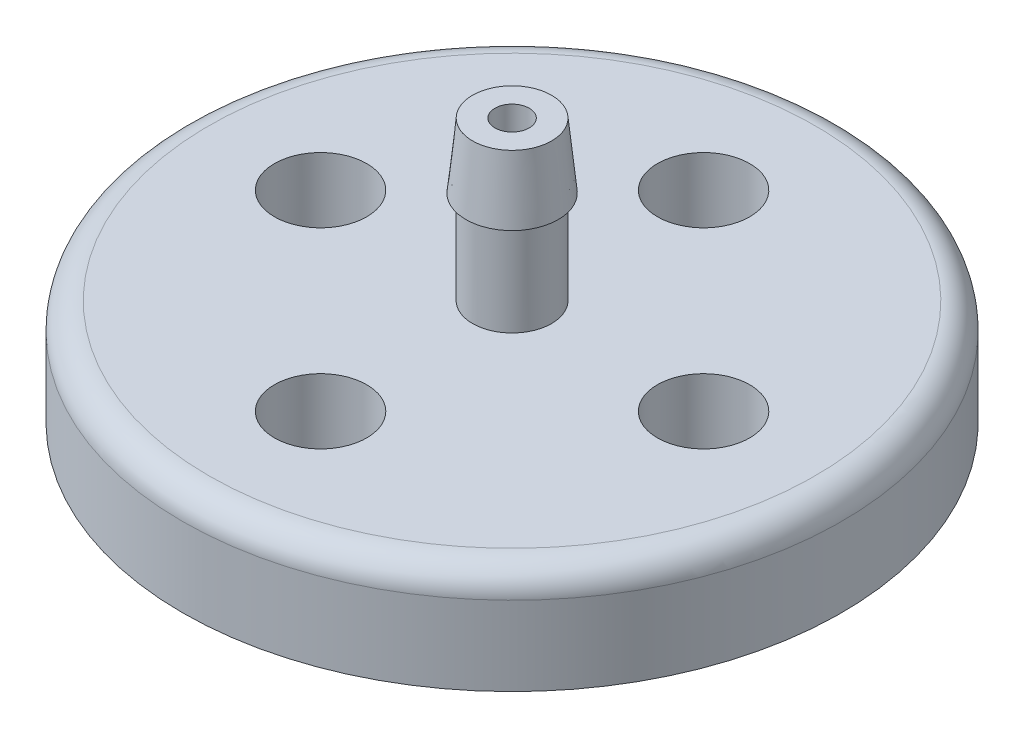
from build123d import *

# Parameters (mm, degrees)
SKETCH1_R           = 12.5
BOSS_EXTRUDE1_DEPTH = 4
SKETCH2_R           = 1.5
BOSS_EXTRUDE2_DEPTH = 6
FILLET1_R           = 1
CUT_EXTRUDE1_REACH  = 22.31
SKETCH6_R           = 0.65
CUT_EXTRUDE2_REACH  = 22.31
SKETCH7_R           = 1.75
CIRPATTERN1_COUNT   = 4


with BuildPart() as part:
    # Sketch1 → Boss-Extrude1 (new body)
    with BuildSketch(Plane(origin=(0, 0, 0), x_dir=(1, 0, 0), z_dir=(0, 1, 0))):
        with Locations(Location((0, 0, 0), (0, 0, 270))):
            Circle(SKETCH1_R)
    extrude(amount=BOSS_EXTRUDE1_DEPTH)

    # Sketch2 → Boss-Extrude2 (add)
    with BuildSketch(Plane(origin=(0, 4, 0), x_dir=(1, 0, 0), z_dir=(0, 1, 0))):
        with Locations(Location((0, 0, 0), (0, 0, 270))):
            Circle(SKETCH2_R)
    extrude(amount=BOSS_EXTRUDE2_DEPTH)

    # Fillet1
    fillet1_edges = [part.edges().sort_by_distance(p)[0] for p in [
        (0, 4, -12.5),
    ]]
    fillet(fillet1_edges, radius=FILLET1_R)

    # Sketch5 → Revolve1 (revolve)
    with BuildSketch(Plane.XY, mode=Mode.PRIVATE) as revolve1_sk:
        Polygon((0, 7.54), (0, 10), (1.5, 10), (1.75, 7.54), align=None)
    revolve(revolve1_sk.sketch.rotate(Axis((0, 7.54, 0), (0, 1, 0)), 90), axis=Axis((0, 7.54, 0), (0, 1, 0)))

    # Sketch6 → Cut-Extrude1 (cut, up to next)
    with BuildSketch(Plane.XZ, mode=Mode.PRIVATE) as cut_extrude1_sk1:
        with Locations(Location((0, 0, 0), (0, 0, 270))):
            Circle(SKETCH6_R)
    cut_extrude1_tool1 = extrude(cut_extrude1_sk1.sketch, amount=-CUT_EXTRUDE1_REACH, mode=Mode.PRIVATE) & part.part
    add(cut_extrude1_tool1.solids().sort_by_distance((0, 0, 0))[0], mode=Mode.SUBTRACT)

    # Sketch7 → Cut-Extrude2 (cut, up to next)
    with BuildSketch(Plane.XZ, mode=Mode.PRIVATE) as cut_extrude2_sk1:
        with Locations(Location((-7.263210785, 0, 0), (0, 0, 270))):
            Circle(SKETCH7_R)
    cut_extrude2_tool1 = extrude(cut_extrude2_sk1.sketch, amount=-CUT_EXTRUDE2_REACH, mode=Mode.PRIVATE) & part.part
    cut_extrude2 = cut_extrude2_tool1.solids().sort_by_distance((-7.263211, 0, 0))[0]
    add(cut_extrude2, mode=Mode.SUBTRACT)

    # CirPattern1: Cut-Extrude2 ×4 about axis
    cirpattern1_axis = Axis((0, 0, 0), (0, 1, 0))
    for i in range(1, CIRPATTERN1_COUNT):
        add(cut_extrude2.rotate(cirpattern1_axis, i * 360 / CIRPATTERN1_COUNT), mode=Mode.SUBTRACT)


solid = part.part
